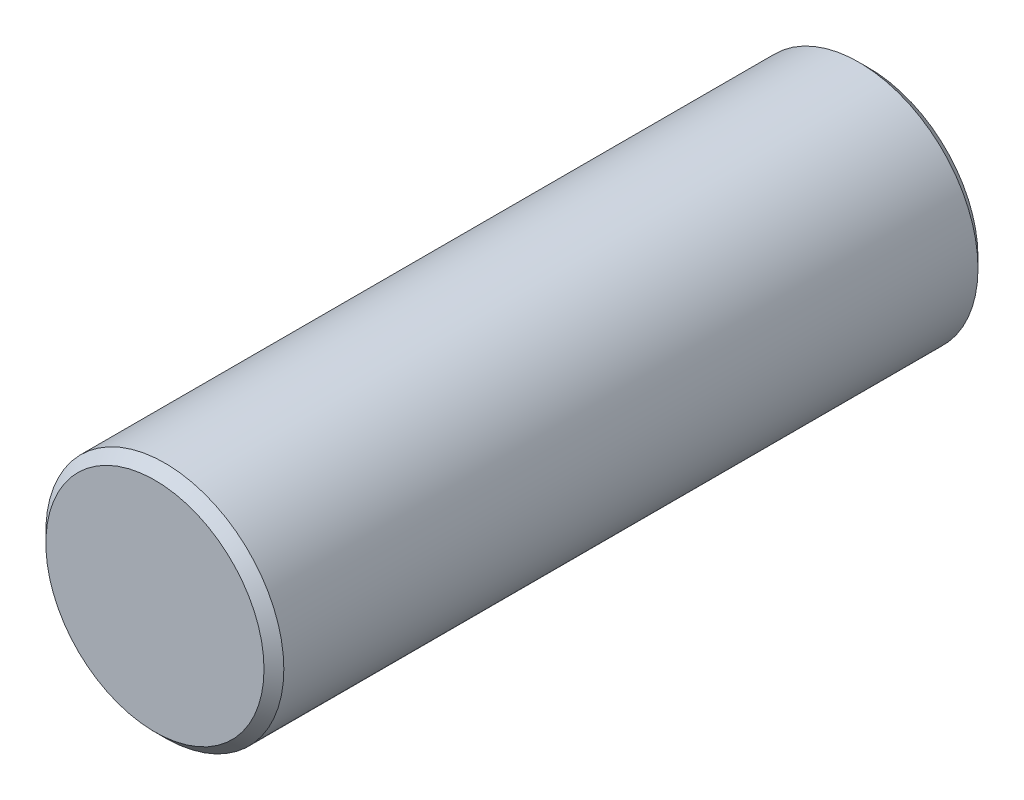
from build123d import *

# Parameters (mm, degrees)
SKETCH1_R           = 1.5
BOSS_EXTRUDE1_DEPTH = 4.5
CHAMFER1_SIZE       = 0.125


with BuildPart() as part:
    # Sketch1 → Boss-Extrude1 (new, symmetric)
    with BuildSketch(Plane.XY):
        Circle(SKETCH1_R)
    extrude(amount=BOSS_EXTRUDE1_DEPTH, both=True)

    # Chamfer1
    chamfer1_edges = [part.edges().sort_by_distance(p)[0] for p in [
        (-1.5, 0, -4.5),
        (-1.5, 0, 4.5),
    ]]
    chamfer(chamfer1_edges, length=CHAMFER1_SIZE)


solid = part.part
